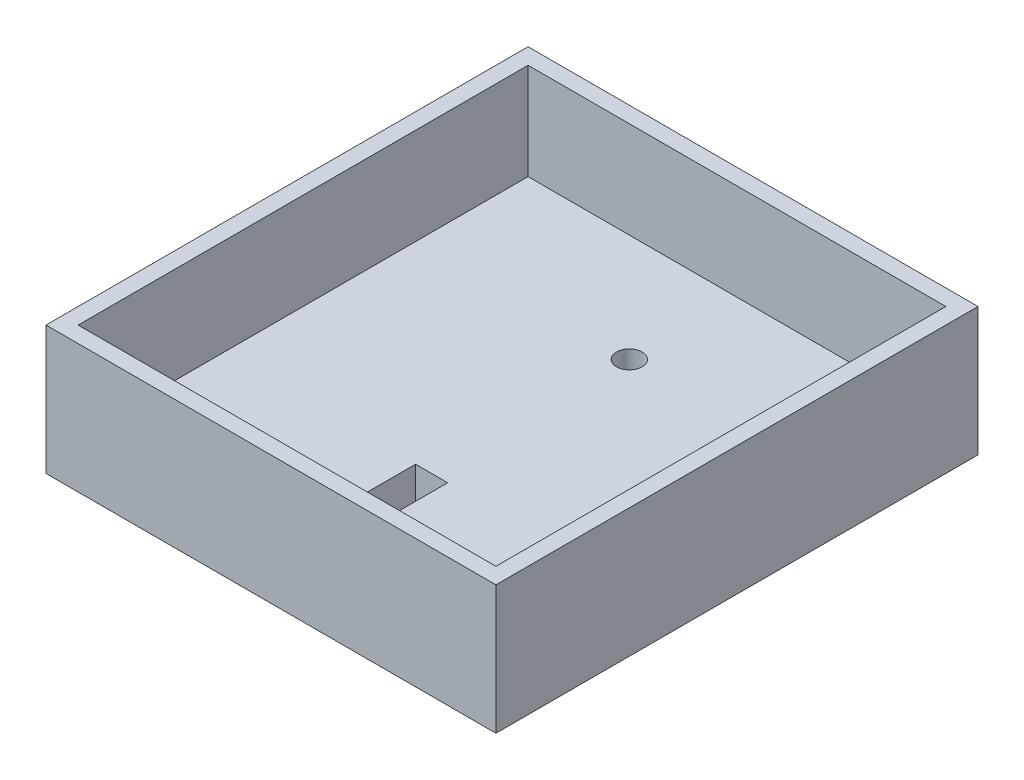
from build123d import *

# Parameters (mm, degrees)
SKETCH3_W           = 140
SKETCH3_H           = 150
BOSS_EXTRUDE1_DEPTH = 15
SKETCH19_W          = 15
SKETCH19_H          = 15
CUT_EXTRUDE1_DEPTH  = 5
SKETCH20_W          = 15
SKETCH20_H          = 15
CUT_EXTRUDE2_DEPTH  = 5
SKETCH21_W          = 15
SKETCH21_H          = 15
CUT_EXTRUDE3_DEPTH  = 5
SKETCH22_W          = 15
SKETCH22_H          = 15
CUT_EXTRUDE4_DEPTH  = 5
SKETCH24_W          = 20
SKETCH24_H          = 20
CUT_EXTRUDE6_DEPTH  = 5
SKETCH25_R          = 4
CUT_EXTRUDE7_DEPTH  = 206.730406114
SKETCH26_W          = 10
SKETCH26_H          = 20
CUT_EXTRUDE8_DEPTH  = 206.730406114
SKETCH27_W          = 5
SKETCH27_H          = 150
BOSS_EXTRUDE2_DEPTH = 30
SKETCH28_W          = 135
SKETCH28_H          = 5
BOSS_EXTRUDE3_DEPTH = 30
SKETCH29_W          = 5
SKETCH29_H          = 145
BOSS_EXTRUDE4_DEPTH = 30
SKETCH30_W          = 130
SKETCH30_H          = 5
BOSS_EXTRUDE5_DEPTH = 30
CHAMFER2_SIZE       = 5


with BuildPart() as part:
    # Sketch3 → Boss-Extrude1 (new body)
    with BuildSketch(Plane(origin=(0, 0, 0), x_dir=(1, 0, 0), z_dir=(0, 1, 0))):
        with Locations((70, 75)):
            Rectangle(SKETCH3_W, SKETCH3_H)
    extrude(amount=BOSS_EXTRUDE1_DEPTH)

    # Sketch19 → Cut-Extrude1 (cut)
    with BuildSketch(Plane.XZ):
        with Locations((17.5, -17.5)):
            Rectangle(SKETCH19_W, SKETCH19_H)
    extrude(amount=-CUT_EXTRUDE1_DEPTH, mode=Mode.SUBTRACT)

    # Sketch20 → Cut-Extrude2 (cut)
    with BuildSketch(Plane.XZ):
        with Locations((122.5, -17.5)):
            Rectangle(SKETCH20_W, SKETCH20_H)
    extrude(amount=-CUT_EXTRUDE2_DEPTH, mode=Mode.SUBTRACT)

    # Sketch21 → Cut-Extrude3 (cut)
    with BuildSketch(Plane.XZ):
        with Locations((17.5, -132.5)):
            Rectangle(SKETCH21_W, SKETCH21_H)
    extrude(amount=-CUT_EXTRUDE3_DEPTH, mode=Mode.SUBTRACT)

    # Sketch22 → Cut-Extrude4 (cut)
    with BuildSketch(Plane.XZ):
        with Locations((122.5, -132.5)):
            Rectangle(SKETCH22_W, SKETCH22_H)
    extrude(amount=-CUT_EXTRUDE4_DEPTH, mode=Mode.SUBTRACT)

    # Sketch24 → Cut-Extrude6 (cut)
    with BuildSketch(Plane.XZ):
        with Locations((70, -75)):
            Rectangle(SKETCH24_W, SKETCH24_H)
    extrude(amount=-CUT_EXTRUDE6_DEPTH, mode=Mode.SUBTRACT)

    # Sketch25 → Cut-Extrude7 (cut, through all)
    with BuildSketch(Plane(origin=(0, 0, 0), x_dir=(-1, 0, 0), z_dir=(0, -1, 0))):
        with Locations(Location((-70, 111.5, 0), (0, 0, 90))):
            Circle(SKETCH25_R)
    extrude(amount=-CUT_EXTRUDE7_DEPTH, mode=Mode.SUBTRACT)

    # Sketch26 → Cut-Extrude8 (cut, through all)
    with BuildSketch(Plane.XZ):
        with Locations((70, -40)):
            Rectangle(SKETCH26_W, SKETCH26_H)
    extrude(amount=-CUT_EXTRUDE8_DEPTH, mode=Mode.SUBTRACT)

    # Sketch27 → Boss-Extrude2 (add)
    with BuildSketch(Plane(origin=(0, 15, 0), x_dir=(1, 0, 0), z_dir=(0, 1, 0))):
        with Locations((2.5, 75)):
            Rectangle(SKETCH27_W, SKETCH27_H)
    extrude(amount=BOSS_EXTRUDE2_DEPTH)

    # Sketch28 → Boss-Extrude3 (add)
    with BuildSketch(Plane(origin=(0, 15, 0), x_dir=(1, 0, 0), z_dir=(0, 1, 0))):
        with Locations((72.5, 147.5)):
            Rectangle(SKETCH28_W, SKETCH28_H)
    extrude(amount=BOSS_EXTRUDE3_DEPTH)

    # Sketch29 → Boss-Extrude4 (add)
    with BuildSketch(Plane(origin=(0, 15, 0), x_dir=(1, 0, 0), z_dir=(0, 1, 0))):
        with Locations((137.5, 72.5)):
            Rectangle(SKETCH29_W, SKETCH29_H)
    extrude(amount=BOSS_EXTRUDE4_DEPTH)

    # Sketch30 → Boss-Extrude5 (add)
    with BuildSketch(Plane(origin=(0, 15, 0), x_dir=(1, 0, 0), z_dir=(0, 1, 0))):
        with Locations((70, 2.5)):
            Rectangle(SKETCH30_W, SKETCH30_H)
    extrude(amount=BOSS_EXTRUDE5_DEPTH)

    # Chamfer2
    chamfer2_edges = [part.edges().sort_by_distance(p)[0] for p in [
        (70, 0, 0),
        (140, 0, -75),
        (70, 0, -150),
        (0, 0, -75),
    ]]
    chamfer(chamfer2_edges, length=CHAMFER2_SIZE)


solid = part.part
